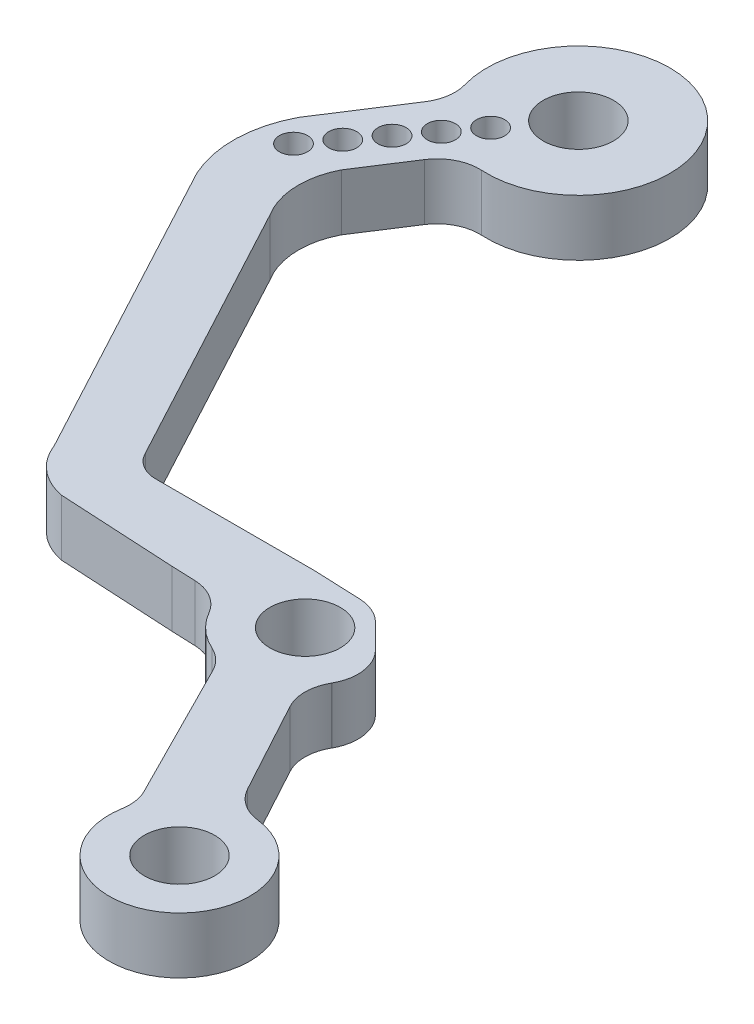
from build123d import *

# Parameters (mm, degrees)
SKETCH2_R           = 2.5
SKETCH2_R_2         = 3.4
BOSS_EXTRUDE1_DEPTH = 4
FILLET1_R           = 3
SKETCH3_R           = 1
CUT_EXTRUDE2_DEPTH  = 4
SKETCH5_W           = 0.9
SKETCH5_H           = 4


with BuildPart() as part:
    # Sketch2 → Boss-Extrude1 (new body)
    with BuildSketch(Plane(origin=(0, 0, 0), x_dir=(1, 0, 0), z_dir=(0, 1, 0))):
        with BuildLine():
            ThreePointArc((49.0624911, 100.728722197), (55.253975507, 111.876765002), (45.278809785, 103.932622106))
            Line((45.278809785, 103.932622106), (41.677103445, 98.359455452))
            Line((41.677103445, 98.359455452), (40.917682236, 97.184351056))
            ThreePointArc((40.917682236, 97.184351056), (40.000914232, 93.684113367), (40.729811239, 90.139986308))
            Line((40.729811239, 90.139986308), (51.995593872, 69.121735128))
            Line((51.995593872, 69.121735128), (52.448751423, 68.276291936))
            ThreePointArc((52.448751423, 68.276291936), (53.733769558, 66.46917356), (55.737555004, 65.519546097))
            Line((55.737555004, 65.519546097), (56.575581952, 65.474059755))
            Line((56.575581952, 65.474059755), (56.904280571, 65.456218685))
            Line((56.904280571, 65.456218685), (64.043852088, 65.068697747))
            Line((64.043852088, 65.068697747), (67.659658755, 64.927019071))
            ThreePointArc((67.659658755, 64.927019071), (68.973857559, 62.514332624), (71.364365032, 61.16020988))
            Line((71.364365032, 61.16020988), (77.3922419, 49.235496946))
            ThreePointArc((77.3922419, 49.235496946), (85.295038859, 43.696471142), (81.278467798, 52.471558808))
            Line((81.278467798, 52.471558808), (75.926202221, 62.342787356))
            ThreePointArc((75.926202221, 62.342787356), (77.117833046, 64.012589982), (77.538655529, 66.020358214))
            Line((77.538655529, 66.020358214), (73.882441794, 69.676571949))
            Line((73.882441794, 69.676571949), (69.341583584, 69.864669723))
            Line((69.341583584, 69.864669723), (65.404712603, 69.864669723))
            Line((65.404712603, 69.864669723), (58.04793187, 69.864669723))
            ThreePointArc((58.04793187, 69.864669723), (56.992330015, 70.157110244), (56.212176606, 70.925990854))
            ThreePointArc((56.212176606, 70.925990854), (56.161986001, 71.014595828), (56.115987655, 71.105447853))
            Line((56.115987655, 71.105447853), (45.913475043, 90.139986308))
            ThreePointArc((45.913475043, 90.139986308), (45.708651409, 90.489699119), (45.530826332, 90.853883157))
            ThreePointArc((45.530826332, 90.853883157), (45.074746145, 93.175228741), (45.661998303, 95.466907026))
            Line((45.661998303, 95.466907026), (49.0624911, 100.728722197))
        make_face()
        with Locations(Location((82.095552315, 47.538773298, 0), (0, 0, 270))):
            Circle(SKETCH2_R, mode=Mode.SUBTRACT)
        with Locations(Location((72.538655529, 66.020358214, 0), (0, 0, 270))):
            Circle(SKETCH2_R, mode=Mode.SUBTRACT)
        with Locations(Location((51.053576092, 106.916256485, 0), (0, 0, 270))):
            Circle(SKETCH2_R_2, mode=Mode.SUBTRACT)
    extrude(amount=BOSS_EXTRUDE1_DEPTH)

    # Fillet1
    fillet1_edges = [part.edges().sort_by_distance(p)[0] for p in [
        (71.364365032, 2, -61.16020988),
        (67.659658755, 2, -64.927019071),
        (45.278809785, 2, -103.932622106),
        (49.0624911, 2, -100.728722197),
        (73.882441794, 2, -69.676571949),
        (77.538655529, 2, -66.020358214),
        (75.926202221, 2, -62.342787356),
        (81.278467798, 2, -52.471558808),
        (77.3922419, 2, -49.235496946),
    ]]
    fillet(fillet1_edges, radius=FILLET1_R)

    # Sketch3 → Cut-Extrude2 (cut)
    with BuildSketch(Plane(origin=(0, 4, 0), x_dir=(1, 0, 0), z_dir=(0, 1, 0))):
        with Locations(Location((48.374282672, 103.36324554, 0), (0, 0, 270))):
            Circle(SKETCH3_R)
        with Locations(Location((46.86906165, 101.367171976, 0), (0, 0, 270))):
            Circle(SKETCH3_R)
        with Locations(Location((45.363840628, 99.371098411, 0), (0, 0, 270))):
            Circle(SKETCH3_R)
        with Locations(Location((43.858619606, 97.375024847, 0), (0, 0, 270))):
            Circle(SKETCH3_R)
        with Locations(Location((42.353398584, 95.378951282, 0), (0, 0, 270))):
            Circle(SKETCH3_R)
    extrude(amount=-CUT_EXTRUDE2_DEPTH, mode=Mode.SUBTRACT)

    # Sweep1: sweep along a path in Sketch4
    with BuildLine(Plane(origin=(0, 4, 0), x_dir=(1, 0, 0), z_dir=(0, 1, 0))) as sweep1_path:
        CenterArc((51.053576092, 106.916256485), 3.4, 0, 360)
    # Sketch5 → Sweep1 (sweep)
    with BuildSketch(Plane(origin=(45.965783702, 0, -109.06060876), x_dir=(0.9214977377283068, 0, 0.38838372695262713), z_dir=(-0.38838372695262713, 0, 0.9214977377283068))):
        with Locations((2.571220706, 2)):
            Rectangle(SKETCH5_W, SKETCH5_H)
    sweep(path=sweep1_path.line)


solid = part.part
